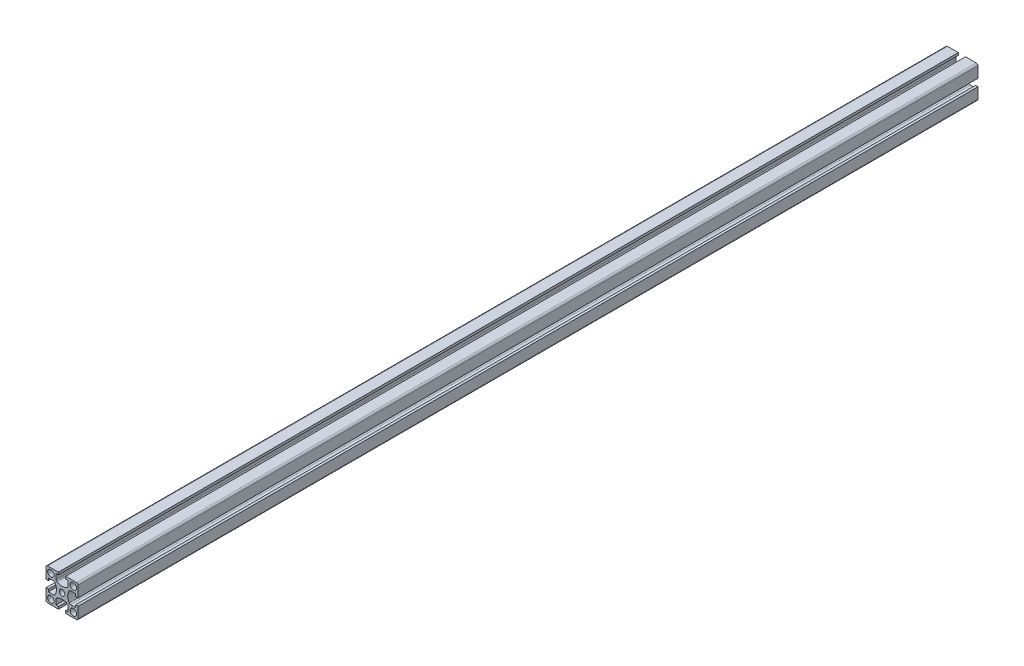
from build123d import *

# Parameters (mm, degrees)
SKETCH1_R           = 2
SKETCH1_R_2         = 1.75
BOSS_EXTRUDE1_DEPTH = 560


with BuildPart() as part:
    # Sketch1 → Boss-Extrude1 (new body)
    with BuildSketch(Plane.XY):
        with BuildLine():
            Line((-10, 9), (-10, 2.25))
            Line((-10, 2.25), (-8.5, 2.25))
            Line((-8.5, 2.25), (-8.5, 3.75))
            Line((-8.5, 3.75), (-5.236860279, 3.75))
            ThreePointArc((-5.236860279, 3.75), (-4.736860279, 3.616025404), (-4.370834875, 3.25))
            ThreePointArc((-4.370834875, 3.25), (-3.5, 0), (-4.370834875, -3.25))
            ThreePointArc((-4.370834875, -3.25), (-4.736860279, -3.616025404), (-5.236860279, -3.75))
            Line((-5.236860279, -3.75), (-8.5, -3.75))
            Line((-8.5, -3.75), (-8.5, -2.25))
            Line((-8.5, -2.25), (-10, -2.25))
            Line((-10, -2.25), (-10, -9))
            ThreePointArc((-10, -9), (-9.707106781, -9.707106781), (-9, -10))
            Line((-9, -10), (-2.25, -10))
            Line((-2.25, -10), (-2.25, -8.5))
            Line((-2.25, -8.5), (-3.75, -8.5))
            Line((-3.75, -8.5), (-3.75, -5.236860279))
            ThreePointArc((-3.75, -5.236860279), (-3.616025404, -4.736860279), (-3.25, -4.370834875))
            ThreePointArc((-3.25, -4.370834875), (0, -3.5), (3.25, -4.370834875))
            ThreePointArc((3.25, -4.370834875), (3.616025404, -4.736860279), (3.75, -5.236860279))
            Line((3.75, -5.236860279), (3.75, -8.5))
            Line((3.75, -8.5), (2.25, -8.5))
            Line((2.25, -8.5), (2.25, -10))
            Line((2.25, -10), (9, -10))
            ThreePointArc((9, -10), (9.707106781, -9.707106781), (10, -9))
            Line((10, -9), (10, -2.25))
            Line((10, -2.25), (8.5, -2.25))
            Line((8.5, -2.25), (8.5, -3.75))
            Line((8.5, -3.75), (5.236860279, -3.75))
            ThreePointArc((5.236860279, -3.75), (4.736860279, -3.616025404), (4.370834875, -3.25))
            ThreePointArc((4.370834875, -3.25), (3.5, 0), (4.370834875, 3.25))
            ThreePointArc((4.370834875, 3.25), (4.736860279, 3.616025404), (5.236860279, 3.75))
            Line((5.236860279, 3.75), (8.5, 3.75))
            Line((8.5, 3.75), (8.5, 2.25))
            Line((8.5, 2.25), (10, 2.25))
            Line((10, 2.25), (10, 9))
            ThreePointArc((10, 9), (9.707106781, 9.707106781), (9, 10))
            Line((9, 10), (2.25, 10))
            Line((2.25, 10), (2.25, 8.5))
            Line((2.25, 8.5), (3.75, 8.5))
            Line((3.75, 8.5), (3.75, 5.236860279))
            ThreePointArc((3.75, 5.236860279), (3.616025404, 4.736860279), (3.25, 4.370834875))
            ThreePointArc((3.25, 4.370834875), (0, 3.5), (-3.25, 4.370834875))
            ThreePointArc((-3.25, 4.370834875), (-3.616025404, 4.736860279), (-3.75, 5.236860279))
            Line((-3.75, 5.236860279), (-3.75, 8.5))
            Line((-3.75, 8.5), (-2.25, 8.5))
            Line((-2.25, 8.5), (-2.25, 10))
            Line((-2.25, 10), (-9, 10))
            ThreePointArc((-9, 10), (-9.707106781, 9.707106781), (-10, 9))
        make_face()
        with Locations((-7, -7)):
            Circle(SKETCH1_R, mode=Mode.SUBTRACT)
        with Locations((7, -7)):
            Circle(SKETCH1_R, mode=Mode.SUBTRACT)
        with Locations((7, 7)):
            Circle(SKETCH1_R, mode=Mode.SUBTRACT)
        Circle(SKETCH1_R_2, mode=Mode.SUBTRACT)
        with Locations((-7, 7)):
            Circle(SKETCH1_R, mode=Mode.SUBTRACT)
    extrude(amount=BOSS_EXTRUDE1_DEPTH)


solid = part.part
